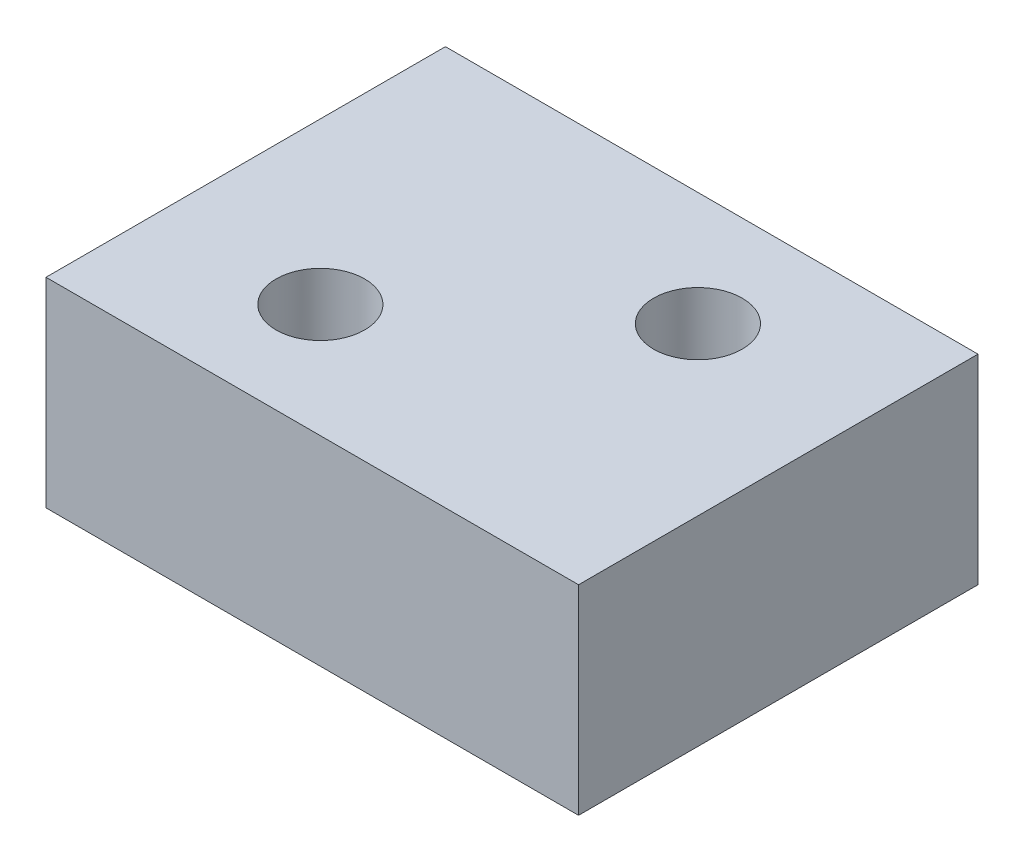
from build123d import *

# Parameters (mm, degrees)
SKETCH1_W               = 40
SKETCH1_H               = 30
BOSS_EXTRUDE1_DEPTH     = 10
SKETCH2_R               = 2
CUT_EXTRUDE1_DEPTH      = 5
SKETCH3_R               = 4.8125
CUT_EXTRUDE2_DEPTH      = 4
SKETCH5_W               = 40
SKETCH5_H               = 30
BOSS_EXTRUDE2_DEPTH     = 5
CUT_EXTRUDE3_DEPTH      = 27.570660511
CUT_EXTRUDE3_DEPTH_BACK = 1
SKETCH4_R               = 3.325


with BuildPart() as part:
    # Sketch1 → Boss-Extrude1 (new body)
    with BuildSketch(Plane(origin=(0, 0, 0), x_dir=(1, 0, 0), z_dir=(0, 1, 0))):
        Rectangle(SKETCH1_W, SKETCH1_H)
    extrude(amount=BOSS_EXTRUDE1_DEPTH)

    # Sketch2 → Cut-Extrude1 (cut)
    with BuildSketch(Plane(origin=(0, 0, 0), x_dir=(-1, 0, 0), z_dir=(0, -1, 0))):
        with Locations(Location((-13.333333333, -10, 0), (0, 0, 90))):
            Circle(SKETCH2_R)
        with Locations(Location((13.333333333, -10, 0), (0, 0, 270))):
            Circle(SKETCH2_R)
        with Locations(Location((-13.333333333, 10, 0), (0, 0, 270))):
            Circle(SKETCH2_R)
        with Locations(Location((13.333333333, 10, 0), (0, 0, 90))):
            Circle(SKETCH2_R)
    extrude(amount=-CUT_EXTRUDE1_DEPTH, mode=Mode.SUBTRACT)

    # Sketch3 → Cut-Extrude2 (cut)
    with BuildSketch(Plane(origin=(0, 10, 0), x_dir=(1, 0, 0), z_dir=(0, 1, 0))):
        with Locations(Location((-7.9286, -6.465, 0), (0, 0, 270))):
            Circle(SKETCH3_R)
        with Locations(Location((7.5, 6.4636, 0), (0, 0, 270))):
            Circle(SKETCH3_R)
    extrude(amount=-CUT_EXTRUDE2_DEPTH, mode=Mode.SUBTRACT)

    # Sketch5 → Boss-Extrude2 (add)
    with BuildSketch(Plane(origin=(0, 10, 0), x_dir=(1, 0, 0), z_dir=(0, 1, 0))):
        Rectangle(SKETCH5_W, SKETCH5_H)
    extrude(amount=BOSS_EXTRUDE2_DEPTH)

    # Sketch4 → Cut-Extrude3 (cut, two sides: drawn at the far end of the back side and taken through both)
    with BuildSketch(Plane(origin=(0, 6, 0), x_dir=(1, 0, 0), z_dir=(0, 1, 0)).offset(-CUT_EXTRUDE3_DEPTH_BACK)):
        with Locations(Location((-7.9286, -6.465, 0), (0, 0, 90))):
            Circle(SKETCH4_R)
        with Locations(Location((7.5, 6.4636, 0), (0, 0, 90))):
            Circle(SKETCH4_R)
    extrude(amount=CUT_EXTRUDE3_DEPTH + CUT_EXTRUDE3_DEPTH_BACK, mode=Mode.SUBTRACT)


solid = part.part
